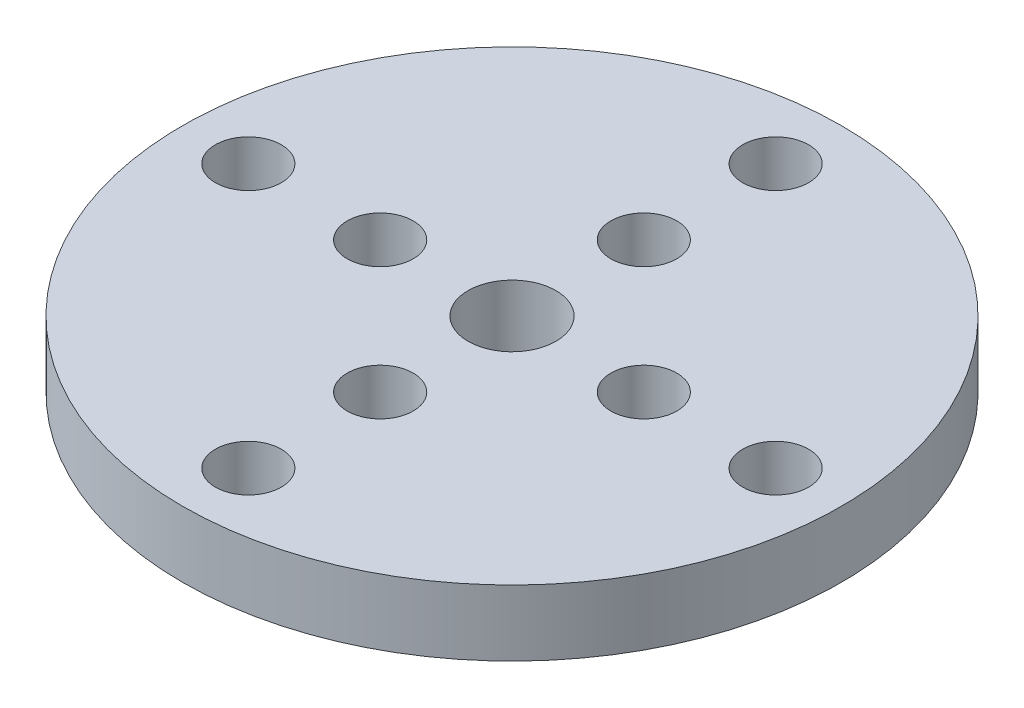
from build123d import *

# Parameters (mm, degrees)
SKETCH_1_R      = 15
SKETCH_1_R_2    = 2
SKETCH_1_R_3    = 1.5
EXTRUDE_1_DEPTH = 3


with BuildPart() as part:
    # 草图1 → 凸台-拉伸1 (new body)
    with BuildSketch(Plane(origin=(0, 0, 0), x_dir=(1, 0, 0), z_dir=(0, 1, 0))):
        with Locations(Location((0, 0, 0), (0, 0, 270))):
            Circle(SKETCH_1_R)
        with Locations(Location((0, 0, 0), (0, 0, 270))):
            Circle(SKETCH_1_R_2, mode=Mode.SUBTRACT)
        with Locations(Location((0, 6, 0), (0, 0, 270))):
            Circle(SKETCH_1_R_3, mode=Mode.SUBTRACT)
        with Locations(Location((6, 0, 0), (0, 0, 270))):
            Circle(SKETCH_1_R_3, mode=Mode.SUBTRACT)
        with Locations(Location((0, -6, 0), (0, 0, 270))):
            Circle(SKETCH_1_R_3, mode=Mode.SUBTRACT)
        with Locations(Location((-6, 0, 0), (0, 0, 270))):
            Circle(SKETCH_1_R_3, mode=Mode.SUBTRACT)
        with Locations(Location((0, 12, 0), (0, 0, 270))):
            Circle(SKETCH_1_R_3, mode=Mode.SUBTRACT)
        with Locations(Location((12, 0, 0), (0, 0, 270))):
            Circle(SKETCH_1_R_3, mode=Mode.SUBTRACT)
        with Locations(Location((0, -12, 0), (0, 0, 270))):
            Circle(SKETCH_1_R_3, mode=Mode.SUBTRACT)
        with Locations(Location((-12, 0, 0), (0, 0, 270))):
            Circle(SKETCH_1_R_3, mode=Mode.SUBTRACT)
    extrude(amount=EXTRUDE_1_DEPTH)


solid = part.part
